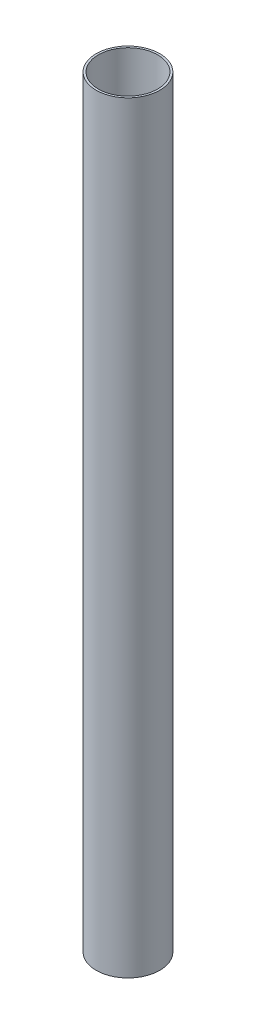
from build123d import *

# Parameters (mm, degrees)
SKETCH1_R           = 25.4
SKETCH1_R_2         = 23.749
BOSS_EXTRUDE1_DEPTH = 609.6


with BuildPart() as part:
    # Sketch1 → Boss-Extrude1 (new body)
    with BuildSketch(Plane(origin=(0, 0, 0), x_dir=(1, 0, 0), z_dir=(0, 1, 0))):
        with Locations(Location((0, 0, 0), (0, 0, 270))):
            Circle(SKETCH1_R)
        with Locations(Location((0, 0, 0), (0, 0, 270))):
            Circle(SKETCH1_R_2, mode=Mode.SUBTRACT)
    extrude(amount=BOSS_EXTRUDE1_DEPTH)


solid = part.part
